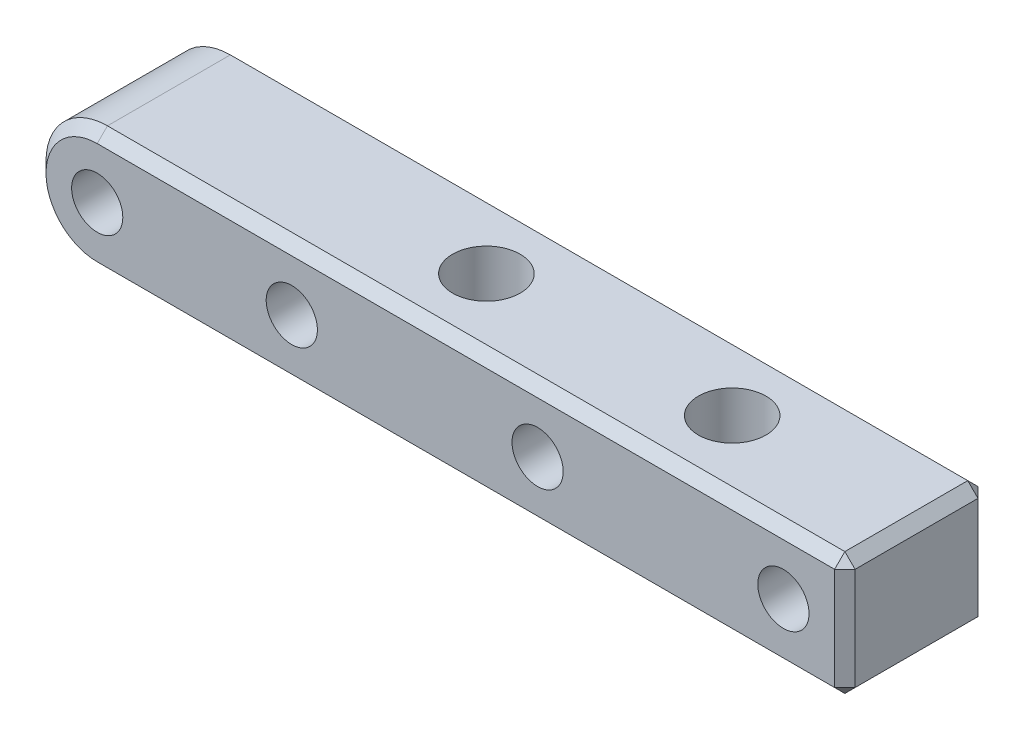
from build123d import *

# Parameters (mm, degrees)
SKETCH_2_R         = 0.5
EXTRUDE_1_DEPTH    = 3.5
HOLE_WIZARD_M3_1_D = 2.5
HOLE_WIZARD_M4_1_D = 3.3
CHAMFER_1_SIZE     = 0.5


with BuildPart() as part:
    # 草图2 → 凸台-拉伸1 (new, symmetric)
    with BuildSketch(Plane.XY):
        with BuildLine():
            Line((3, 3), (3, -3))
            Line((3, -3), (-33.5, -3))
            ThreePointArc((-33.5, -3), (-36.5, 0), (-33.5, 3))
            Line((-33.5, 3), (3, 3))
        make_face()
        with Locations((-33.5, 0)):
            Circle(SKETCH_2_R, mode=Mode.SUBTRACT)
        with Locations((-24, 0)):
            Circle(SKETCH_2_R, mode=Mode.SUBTRACT)
        with Locations((-12, 0)):
            Circle(SKETCH_2_R, mode=Mode.SUBTRACT)
        Circle(SKETCH_2_R, mode=Mode.SUBTRACT)
    extrude(amount=EXTRUDE_1_DEPTH, both=True)

    # M3 螺纹孔1 (through all)
    with Locations(Plane.XY.offset(3.5)):
        with Locations((0, 0), (-12, 0), (-24, 0), (-33.5, 0)):
            Hole(HOLE_WIZARD_M3_1_D / 2)

    # M4 螺纹孔1 (through all)
    with Locations(Plane(origin=(0, 3, 0), x_dir=(1, 0, 0), z_dir=(0, 1, 0))):
        with Locations((-6, 0), (-18, 0)):
            Hole(HOLE_WIZARD_M4_1_D / 2)

    # 倒角1
    chamfer_1_edges = [part.edges().sort_by_distance(p)[0] for p in [
        (-15.25, -3, 3.5),
        (3, 0, 3.5),
        (-15.25, 3, 3.5),
        (3, 0, -3.5),
        (-15.25, -3, -3.5),
        (-36.5, 0, -3.5),
        (-15.25, 3, -3.5),
        (-36.5, 0, 3.5),
        (3, 3, 0),
        (3, -3, 0),
    ]]
    chamfer(chamfer_1_edges, length=CHAMFER_1_SIZE)


solid = part.part
